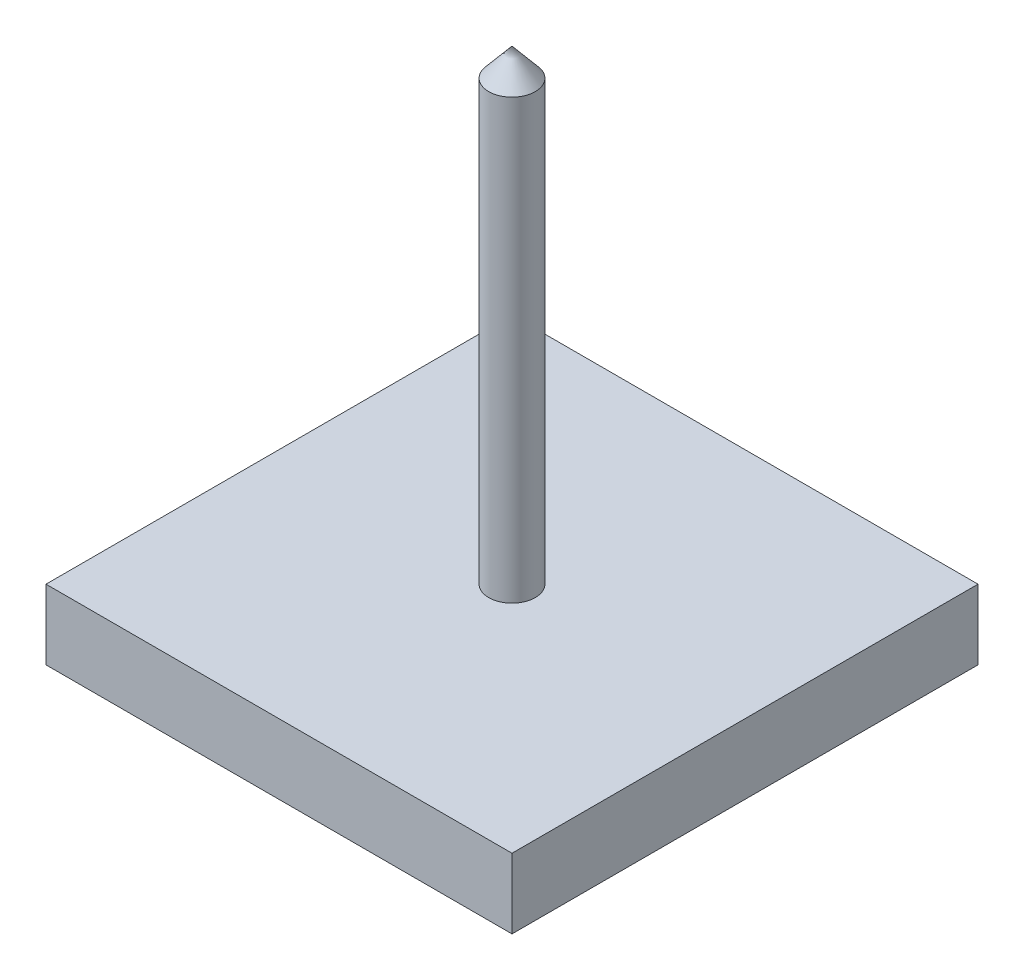
from build123d import *

# Parameters (mm, degrees)
CROQUIS1_W              = 20
CROQUIS1_H              = 20
SALIENTE_EXTRUIR1_DEPTH = 3


with BuildPart() as part:
    # Croquis1 → Saliente-Extruir1 (new body)
    with BuildSketch(Plane(origin=(0, 0, 0), x_dir=(1, 0, 0), z_dir=(0, 1, 0))):
        with Locations((10, 10)):
            Rectangle(CROQUIS1_W, CROQUIS1_H)
    extrude(amount=SALIENTE_EXTRUIR1_DEPTH)

    # Croquis2 → Revolución1 (revolve)
    with BuildSketch(Plane(origin=(10, 0, 0), x_dir=(0, 0, -1), z_dir=(1, 0, 0))):
        Polygon((10, 3), (10, 23), (11, 21.808246407), (11, 3), align=None)
    revolve(axis=Axis((10, 3, -10), (0, 1, 0)))


solid = part.part
